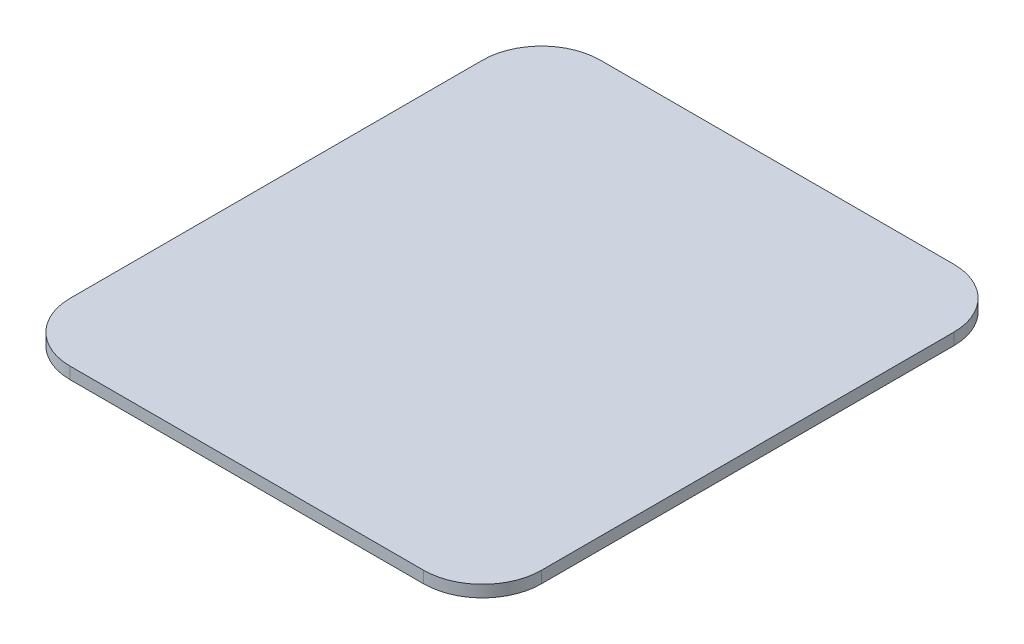
from build123d import *

# Parameters (mm, degrees)
BOSS_EXTRUDE1_DEPTH = 10


with BuildPart() as part:
    # Sketch1 → Boss-Extrude1 (new body)
    with BuildSketch(Plane(origin=(0, 0, 0), x_dir=(1, 0, 0), z_dir=(0, 1, 0))):
        with BuildLine():
            Line((-150, -225), (150, -225))
            ThreePointArc((150, -225), (185.355339059, -210.355339059), (200, -175))
            Line((200, -175), (200, 175))
            ThreePointArc((200, 175), (185.355339059, 210.355339059), (150, 225))
            Line((150, 225), (-150, 225))
            ThreePointArc((-150, 225), (-185.355339059, 210.355339059), (-200, 175))
            Line((-200, 175), (-200, -175))
            ThreePointArc((-200, -175), (-185.355339059, -210.355339059), (-150, -225))
        make_face()
    extrude(amount=BOSS_EXTRUDE1_DEPTH)


solid = part.part
